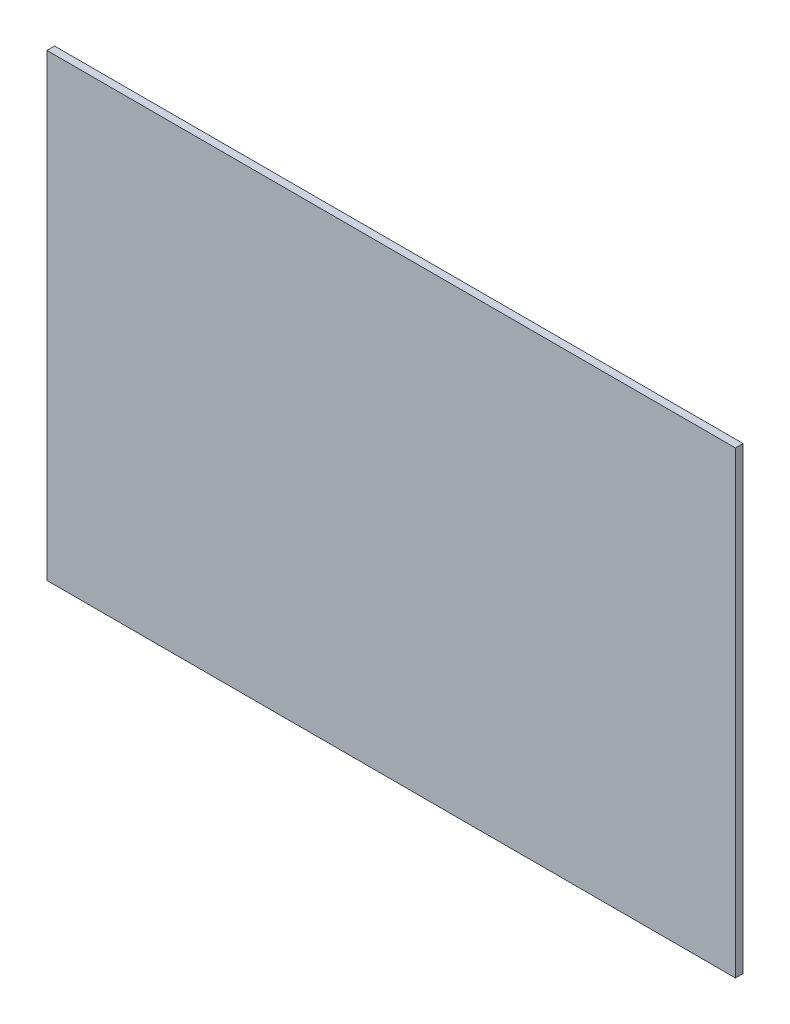
from build123d import *

# Parameters (mm, degrees)
ESBO_O1_W                = 450
ESBO_O1_H                = 300
RESSALTO_EXTRUS_O1_DEPTH = 5


with BuildPart() as part:
    # Esboço1 → Ressalto-extrusão1 (new body)
    with BuildSketch(Plane.XY):
        Rectangle(ESBO_O1_W, ESBO_O1_H)
    extrude(amount=RESSALTO_EXTRUS_O1_DEPTH)


solid = part.part
